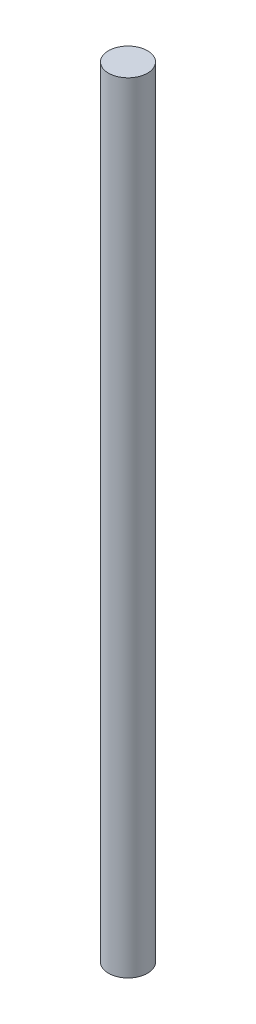
from build123d import *

# Parameters (mm, degrees)
SKETCH1_R           = 6.35
BOSS_EXTRUDE1_DEPTH = 254


with BuildPart() as part:
    # Sketch1 → Boss-Extrude1 (new body)
    with BuildSketch(Plane(origin=(0, 0, 0), x_dir=(1, 0, 0), z_dir=(0, 1, 0))):
        with Locations(Location((0, 0, 0), (0, 0, 270))):
            Circle(SKETCH1_R)
    extrude(amount=BOSS_EXTRUDE1_DEPTH)


solid = part.part
